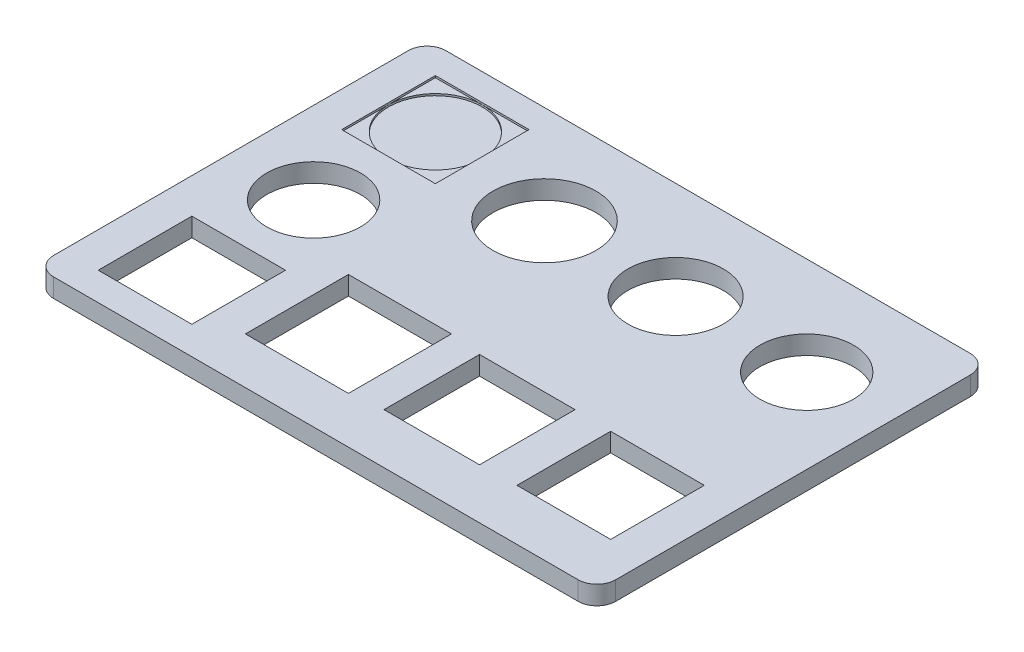
from build123d import *

# Parameters (mm, degrees)
SKETCH1_W           = 300
SKETCH1_H           = 209.332
SKETCH1_R           = 25
SKETCH1_R_2         = 27.5
SKETCH1_R_3         = 25.5
SKETCH1_W_2         = 55
SKETCH1_H_2         = 55
SKETCH1_W_3         = 51
SKETCH1_H_3         = 51
SKETCH1_W_4         = 50
SKETCH1_H_4         = 50
BOSS_EXTRUDE1_DEPTH = 10
SKETCH2_W           = 50
SKETCH2_H           = 50
CUT_EXTRUDE1_DEPTH  = 1
BOSS_EXTRUDE2_START = -9
SKETCH3_R           = 25
BOSS_EXTRUDE2_DEPTH = 8
SKETCH4_W           = 50
SKETCH4_H           = 50
CUT_EXTRUDE2_DEPTH  = 366.950660915
FILLET1_R           = 10
SKETCH5_W           = 50
SKETCH5_H           = 50
BOSS_EXTRUDE3_DEPTH = 10
SKETCH6_R           = 25
SKETCH6_W           = 50
SKETCH6_H           = 50
CUT_EXTRUDE3_DEPTH  = 366.950660915
BOSS_EXTRUDE4_START = -1
SKETCH7_W           = 50
SKETCH7_H           = 50
BOSS_EXTRUDE4_DEPTH = 9
SKETCH8_R           = 25
CUT_EXTRUDE4_DEPTH  = 1


with BuildPart() as part:
    # Sketch1 → Boss-Extrude1 (new body)
    with BuildSketch(Plane(origin=(0, 0, 0), x_dir=(1, 0, 0), z_dir=(0, 1, 0))):
        with Locations((150, 104.666)):
            Rectangle(SKETCH1_W, SKETCH1_H)
        with Locations(Location((45, 156.999, 0), (0, 0, 270))):
            Circle(SKETCH1_R, mode=Mode.SUBTRACT)
        with Locations(Location((45, 52.333, 0), (0, 0, 270))):
            Circle(SKETCH1_R, mode=Mode.SUBTRACT)
        with Locations(Location((115, 156.999, 0), (0, 0, 270))):
            Circle(SKETCH1_R_2, mode=Mode.SUBTRACT)
        with Locations(Location((185, 156.999, 0), (0, 0, 270))):
            Circle(SKETCH1_R_3, mode=Mode.SUBTRACT)
        with Locations(Location((255, 156.999, 0), (0, 0, 270))):
            Circle(SKETCH1_R, mode=Mode.SUBTRACT)
        with Locations((115, 52.333)):
            Rectangle(SKETCH1_W_2, SKETCH1_H_2, mode=Mode.SUBTRACT)
        with Locations((185, 52.333)):
            Rectangle(SKETCH1_W_3, SKETCH1_H_3, mode=Mode.SUBTRACT)
        with Locations((255, 52.333)):
            Rectangle(SKETCH1_W_4, SKETCH1_H_4, mode=Mode.SUBTRACT)
    extrude(amount=BOSS_EXTRUDE1_DEPTH)

    # Sketch2 → Cut-Extrude1 (cut)
    with BuildSketch(Plane(origin=(0, 10, 0), x_dir=(1, 0, 0), z_dir=(0, 1, 0))):
        with Locations((45, 156.999)):
            Rectangle(SKETCH2_W, SKETCH2_H)
    extrude(amount=-CUT_EXTRUDE1_DEPTH, mode=Mode.SUBTRACT)

    # Sketch3 → Boss-Extrude2 (add)
    with BuildSketch(Plane(origin=(0, 9, 0), x_dir=(1, 0, 0), z_dir=(0, 1, 0)).offset(BOSS_EXTRUDE2_START)):
        with Locations(Location((45, 156.999, 0), (0, 0, 270))):
            Circle(SKETCH3_R)
    extrude(amount=BOSS_EXTRUDE2_DEPTH)

    # Sketch4 → Cut-Extrude2 (cut, through all)
    with BuildSketch(Plane(origin=(0, 10, 0), x_dir=(1, 0, 0), z_dir=(0, 1, 0))):
        with Locations((45, 52.333)):
            Rectangle(SKETCH4_W, SKETCH4_H)
    extrude(amount=-CUT_EXTRUDE2_DEPTH, mode=Mode.SUBTRACT)

    # Fillet1
    fillet1_edges = [part.edges().sort_by_distance(p)[0] for p in [
        (0, 5, -209.332),
        (300, 5, -209.332),
        (300, 5, 0),
        (0, 5, 0),
    ]]
    fillet(fillet1_edges, radius=FILLET1_R)

    # Sketch5 → Boss-Extrude3 (add)
    with BuildSketch(Plane(origin=(0, 10, 0), x_dir=(1, 0, 0), z_dir=(0, 1, 0))):
        with Locations((45, 156.999)):
            Rectangle(SKETCH5_W, SKETCH5_H)
        with Locations((45, 52.333)):
            Rectangle(SKETCH5_W, SKETCH5_H)
    extrude(amount=-BOSS_EXTRUDE3_DEPTH)

    # Sketch6 → Cut-Extrude3 (cut, through all)
    with BuildSketch(Plane(origin=(0, 10, 0), x_dir=(1, 0, 0), z_dir=(0, 1, 0))):
        with Locations(Location((43.75, 105, 0), (0, 0, 270))):
            Circle(SKETCH6_R)
        with Locations((43.75, 40)):
            Rectangle(SKETCH6_W, SKETCH6_H)
        with Locations((43.75, 170)):
            Rectangle(SKETCH6_W, SKETCH6_H)
    extrude(amount=-CUT_EXTRUDE3_DEPTH, mode=Mode.SUBTRACT)

    # Sketch7 → Boss-Extrude4 (add)
    with BuildSketch(Plane(origin=(0, 10, 0), x_dir=(1, 0, 0), z_dir=(0, 1, 0)).offset(BOSS_EXTRUDE4_START)):
        with Locations((43.75, 170)):
            Rectangle(SKETCH7_W, SKETCH7_H)
    extrude(amount=-BOSS_EXTRUDE4_DEPTH)

    # Sketch8 → Cut-Extrude4 (cut)
    with BuildSketch(Plane(origin=(0, 9, 0), x_dir=(1, 0, 0), z_dir=(0, 1, 0))):
        with Locations(Location((43.75, 170, 0), (0, 0, 270))):
            Circle(SKETCH8_R)
    extrude(amount=-CUT_EXTRUDE4_DEPTH, mode=Mode.SUBTRACT)


solid = part.part
